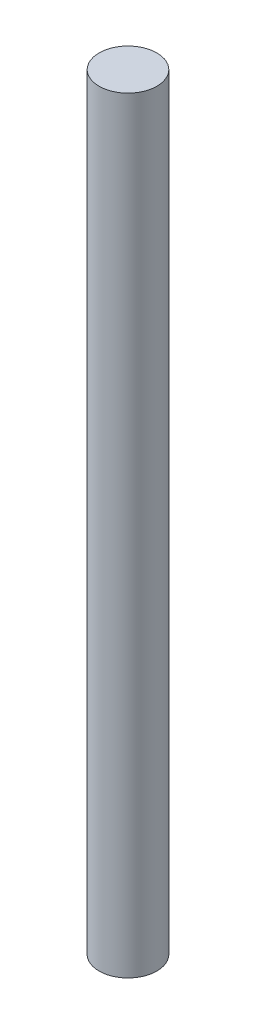
from build123d import *

# Parameters (mm, degrees)
TD_SKETCH_R      = 0.79248
TL_FEATURE_DEPTH = 21.0312


with BuildPart() as part:
    # TD_sketch → TL_feature (new body)
    with BuildSketch(Plane(origin=(0, 0, 0), x_dir=(1, 0, 0), z_dir=(0, 1, 0))):
        with Locations(Location((0, 0, 0), (0, 0, 270))):
            Circle(TD_SKETCH_R)
    extrude(amount=TL_FEATURE_DEPTH)


solid = part.part
